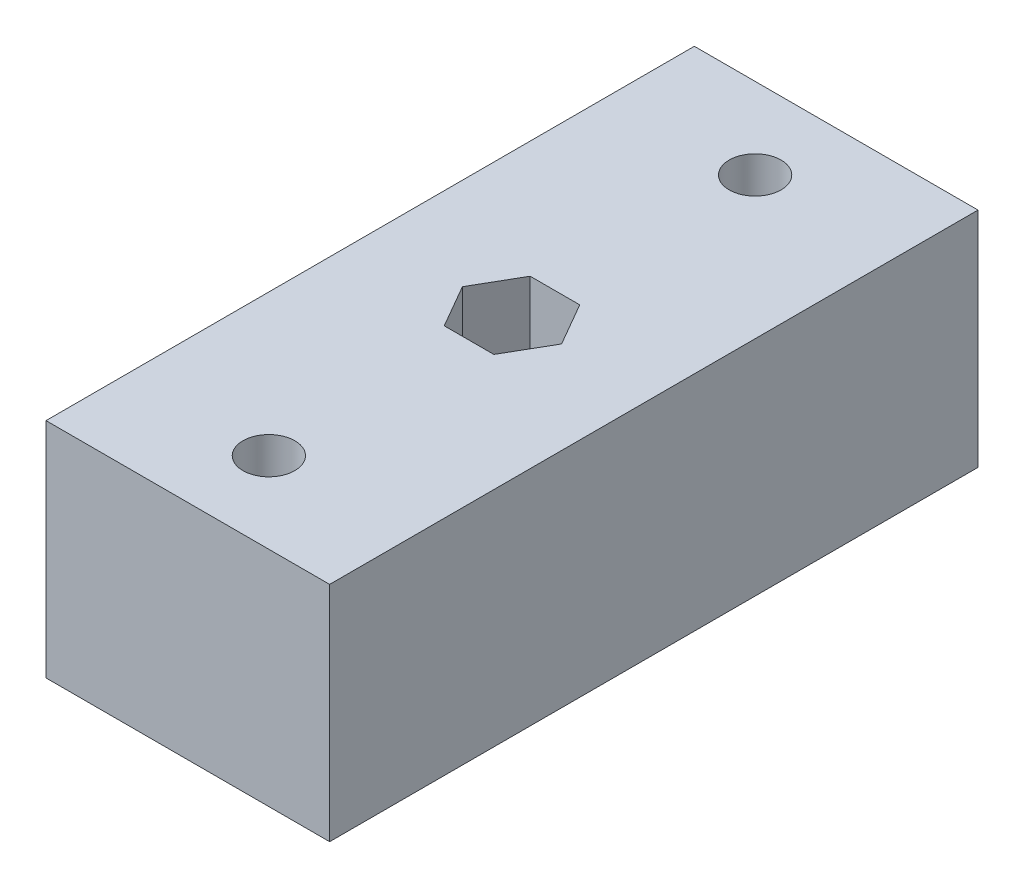
from build123d import *

# Parameters (mm, degrees)
SKETCH1_W           = 22.225
SKETCH1_H           = 17.4625
BOSS_EXTRUDE1_DEPTH = 50.8
CUT_EXTRUDE1_REACH  = 60.134
SKETCH2_R           = 2.032


with BuildPart() as part:
    # Sketch1 → Boss-Extrude1 (new body)
    with BuildSketch(Plane.XY):
        with Locations((11.1125, 8.73125)):
            Rectangle(SKETCH1_W, SKETCH1_H)
    extrude(amount=BOSS_EXTRUDE1_DEPTH)

    # Sketch2 → Cut-Extrude1 (cut, up to next)
    with BuildSketch(Plane.XZ, mode=Mode.PRIVATE) as cut_extrude1_sk1:
        with Locations(Location((11.1125, 44.45, 0), (0, 0, 270))):
            Circle(SKETCH2_R)
    cut_extrude1_tool1 = extrude(cut_extrude1_sk1.sketch, amount=-CUT_EXTRUDE1_REACH, mode=Mode.PRIVATE) & part.part
    # Sketch2 → Cut-Extrude1 (cut, up to next)
    with BuildSketch(Plane.XZ, mode=Mode.PRIVATE) as cut_extrude1_sk2:
        with Locations(Location((11.1125, 6.35, 0), (0, 0, 270))):
            Circle(SKETCH2_R)
    cut_extrude1_tool2 = extrude(cut_extrude1_sk2.sketch, amount=-CUT_EXTRUDE1_REACH, mode=Mode.PRIVATE) & part.part
    # Sketch2 → Cut-Extrude1 (cut, up to next)
    with BuildSketch(Plane.XZ, mode=Mode.PRIVATE) as cut_extrude1_sk3:
        Polygon((14.998644662, 25.4), (13.055572331, 28.7655), (9.169427669, 28.7655), (7.226355338, 25.4), (9.169427669, 22.0345), (13.055572331, 22.0345), align=None)
    cut_extrude1_tool3 = extrude(cut_extrude1_sk3.sketch, amount=-CUT_EXTRUDE1_REACH, mode=Mode.PRIVATE) & part.part
    add(cut_extrude1_tool1.solids().sort_by_distance((11.1125, 0, 44.45))[0], mode=Mode.SUBTRACT)
    add(cut_extrude1_tool2.solids().sort_by_distance((11.1125, 0, 6.35))[0], mode=Mode.SUBTRACT)
    add(cut_extrude1_tool3.solids().sort_by_distance((11.1125, 0, 25.4))[0], mode=Mode.SUBTRACT)


solid = part.part
